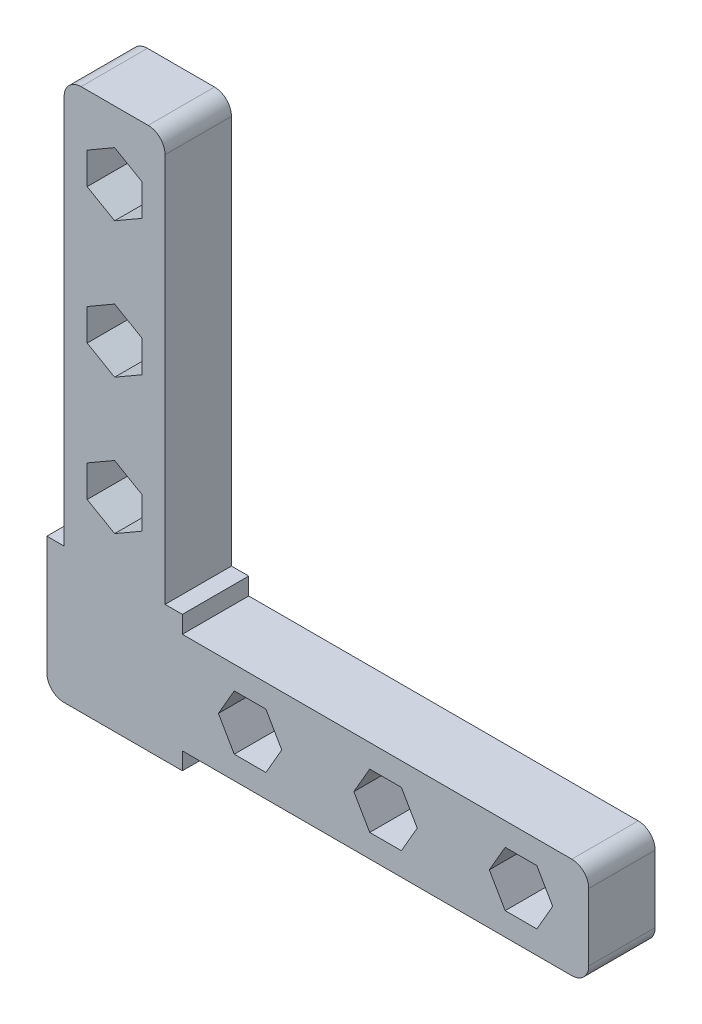
from build123d import *

# Parameters (mm, degrees)
BOSS_EXTRUDE1_DEPTH = 12.446
CUT_EXTRUDE1_DEPTH  = 145.222130465
FILLET1_R           = 3.175


with BuildPart() as part:
    # Sketch1 → Boss-Extrude1 (new body)
    with BuildSketch(Plane.XY):
        Polygon((0, 0), (25.4, 0), (25.4, 3.2385), (101.6, 3.2385), (101.6, 22.1615), (25.4, 22.1615), (25.4, 25.4), (22.1615, 25.4), (22.1615, 101.6), (3.2385, 101.6), (3.2385, 25.4), (0, 25.4), align=None)
    extrude(amount=BOSS_EXTRUDE1_DEPTH)

    # Sketch2 → Cut-Extrude1 (cut, through all)
    with BuildSketch(Plane.XY.offset(12.446)):
        Polygon((17.8435, 85.93039889), (17.8435, 91.86960111), (12.7, 94.839202219), (7.5565, 91.86960111), (7.5565, 85.93039889), (12.7, 82.960797781), align=None)
        Polygon((17.8435, 60.53039889), (17.8435, 66.46960111), (12.7, 69.439202219), (7.5565, 66.46960111), (7.5565, 60.53039889), (12.7, 57.560797781), align=None)
        Polygon((17.8435, 35.13039889), (17.8435, 41.06960111), (12.7, 44.039202219), (7.5565, 41.06960111), (7.5565, 35.13039889), (12.7, 32.160797781), align=None)
        Polygon((41.06960111, 7.5565), (44.039202219, 12.7), (41.06960111, 17.8435), (35.13039889, 17.8435), (32.160797781, 12.7), (35.13039889, 7.5565), align=None)
        Polygon((66.46960111, 7.5565), (69.439202219, 12.7), (66.46960111, 17.8435), (60.53039889, 17.8435), (57.560797781, 12.7), (60.53039889, 7.5565), align=None)
        Polygon((91.86960111, 7.5565), (94.839202219, 12.7), (91.86960111, 17.8435), (85.93039889, 17.8435), (82.960797781, 12.7), (85.93039889, 7.5565), align=None)
    extrude(amount=-CUT_EXTRUDE1_DEPTH, mode=Mode.SUBTRACT)

    # Fillet1
    fillet1_edges = [part.edges().sort_by_distance(p)[0] for p in [
        (3.2385, 101.6, 6.223),
        (22.1615, 101.6, 6.223),
        (101.6, 22.1615, 6.223),
        (101.6, 3.2385, 6.223),
        (0, 0, 6.223),
    ]]
    fillet(fillet1_edges, radius=FILLET1_R)


solid = part.part
